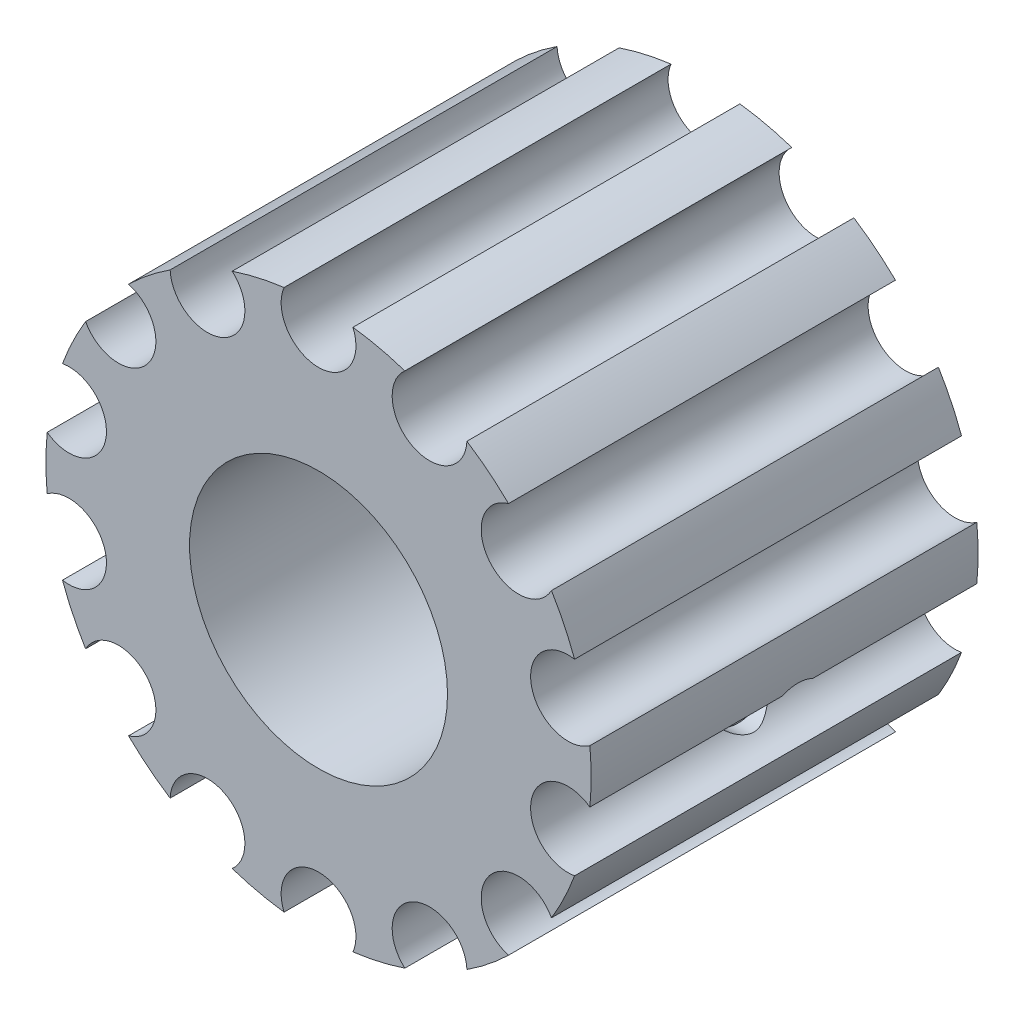
from build123d import *

# Parameters (mm, degrees)
SKETCH1_R           = 5
BOSS_EXTRUDE1_DEPTH = 15
SKETCH7_W           = 1.25
SKETCH7_H           = 2.348715111


with BuildPart() as part:
    # Sketch1 → Boss-Extrude1 (new body)
    with BuildSketch(Plane.XY):
        with BuildLine():
            ThreePointArc((10.519556214, -1.031424774), (10.557381521, -0.516328781), (10.57, 0))
            ThreePointArc((10.57, 0), (10.557381521, 0.516328781), (10.519556214, 1.031424774))
            ThreePointArc((10.519556214, 1.031424774), (8.257639416, 1.884752311), (9.92531109, 3.634982773))
            ThreePointArc((9.92531109, 3.634982773), (9.523240934, 4.586151122), (9.030274215, 5.493545995))
            ThreePointArc((9.030274215, 5.493545995), (6.622112657, 5.280958622), (7.36523638, 7.581437401))
            ThreePointArc((7.36523638, 7.581437401), (6.590287206, 8.26395877), (5.752435659, 8.867603058))
            ThreePointArc((5.752435659, 8.867603058), (3.67499527, 7.631206311), (3.346386275, 10.026295373))
            ThreePointArc((3.346386275, 10.026295373), (2.352046272, 10.304988032), (1.335256672, 10.485322581))
            ThreePointArc((1.335256672, 10.485322581), (1.421024661, 10.208424883), (1.45, 9.92))
            ThreePointArc((1.45, 9.92), (-0.288424883, 8.498975339), (-1.335256672, 10.485322581))
            ThreePointArc((-1.335256672, 10.485322581), (-2.352046272, 10.304988032), (-3.346386275, 10.026295373))
            ThreePointArc((-3.346386275, 10.026295373), (-2.98291066, 9.535012373), (-2.854126692, 8.93761117))
            ThreePointArc((-2.854126692, 8.93761117), (-4.269112426, 7.488033989), (-5.752435659, 8.867603058))
            ThreePointArc((-5.752435659, 8.867603058), (-6.590287206, 8.26395877), (-7.36523638, 7.581437401))
            ThreePointArc((-7.36523638, 7.581437401), (-6.600612193, 7.061440168), (-6.305768306, 6.185018834))
            ThreePointArc((-6.305768306, 6.185018834), (-7.399070653, 4.779576988), (-9.030274215, 5.493545995))
            ThreePointArc((-9.030274215, 5.493545995), (-9.523240934, 4.586151122), (-9.92531109, 3.634982773))
            ThreePointArc((-9.92531109, 3.634982773), (-8.740113044, 3.318901703), (-8.221284889, 2.207407665))
            ThreePointArc((-8.221284889, 2.207407665), (-9.010790158, 0.916575875), (-10.519556214, 1.031424774))
            ThreePointArc((-10.519556214, 1.031424774), (-10.57, 0), (-10.519556214, -1.031424774))
            ThreePointArc((-10.519556214, -1.031424774), (-9.010790158, -0.916575875), (-8.221284889, -2.207407665))
            ThreePointArc((-8.221284889, -2.207407665), (-8.740113044, -3.318901703), (-9.92531109, -3.634982773))
            ThreePointArc((-9.92531109, -3.634982773), (-9.523240934, -4.586151122), (-9.030274215, -5.493545995))
            ThreePointArc((-9.030274215, -5.493545995), (-7.399070653, -4.779576988), (-6.305768306, -6.185018834))
            ThreePointArc((-6.305768306, -6.185018834), (-6.600612193, -7.061440168), (-7.36523638, -7.581437401))
            ThreePointArc((-7.36523638, -7.581437401), (-6.590287206, -8.26395877), (-5.752435659, -8.867603058))
            ThreePointArc((-5.752435659, -8.867603058), (-4.269112426, -7.488033989), (-2.854126692, -8.93761117))
            ThreePointArc((-2.854126692, -8.93761117), (-2.98291066, -9.535012373), (-3.346386275, -10.026295373))
            ThreePointArc((-3.346386275, -10.026295373), (-2.352046272, -10.304988032), (-1.335256672, -10.485322581))
            ThreePointArc((-1.335256672, -10.485322581), (-0.288424883, -8.498975339), (1.45, -9.92))
            ThreePointArc((1.45, -9.92), (1.421024661, -10.208424883), (1.335256672, -10.485322581))
            ThreePointArc((1.335256672, -10.485322581), (2.352046272, -10.304988032), (3.346386275, -10.026295373))
            ThreePointArc((3.346386275, -10.026295373), (3.67499527, -7.631206311), (5.752435659, -8.867603058))
            ThreePointArc((5.752435659, -8.867603058), (6.590287206, -8.26395877), (7.36523638, -7.581437401))
            ThreePointArc((7.36523638, -7.581437401), (6.622112657, -5.280958622), (9.030274215, -5.493545995))
            ThreePointArc((9.030274215, -5.493545995), (9.523240934, -4.586151122), (9.92531109, -3.634982773))
            ThreePointArc((9.92531109, -3.634982773), (8.257639416, -1.884752311), (10.519556214, -1.031424774))
        make_face()
        Circle(SKETCH1_R, mode=Mode.SUBTRACT)
    extrude(amount=BOSS_EXTRUDE1_DEPTH)

    # Sketch7 → M3 Tapped Hole1 (revolve, cut)
    with BuildSketch(Plane(origin=(8.221284889, -2.134982773, 6.95), x_dir=(0, 0, 1), z_dir=(0, 1, 0))):
        with Locations((0.625, 1.174357556)):
            Rectangle(SKETCH7_W, SKETCH7_H)
    revolve(axis=Axis((1.871284889, -2.134982773, 6.95), (1, 0, 0)), mode=Mode.SUBTRACT)


solid = part.part
